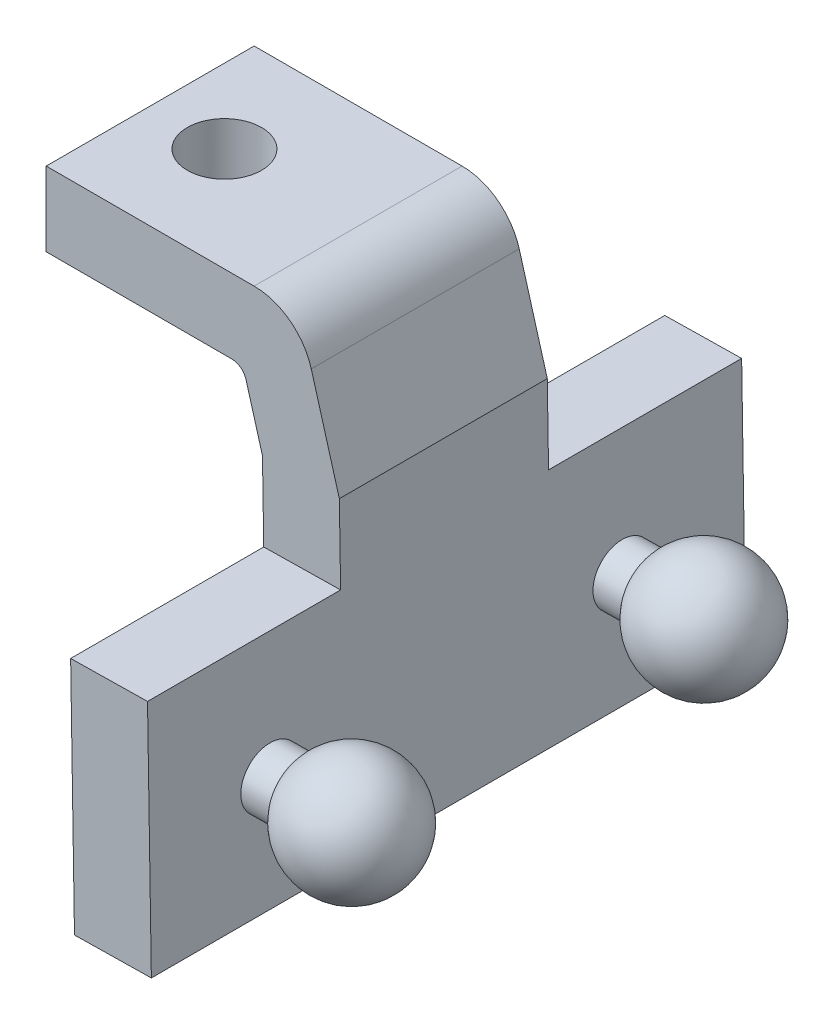
from build123d import *
from build123d.topology import SkipClean

# Parameters (mm, degrees)
EXTRUDE_1_DEPTH     = 3.5
SKETCH_2_R          = 1.25
CUT_EXTRUDE_3_DEPTH = 5.5
SKETCH_3_W          = 20
SKETCH_3_H          = 8
EXTRUDE_2_DEPTH     = 2.58819
SKETCH_4_R          = 1
EXTRUDE_3_DEPTH     = 1


with BuildPart() as part:
    # 草图1 → 凸台-拉伸1 (new, symmetric)
    with BuildSketch(Plane.XY):
        with BuildLine():
            Line((0, 0), (6.245432753, 0))
            ThreePointArc((6.245432753, 0), (6.54659813, -0.100876691), (6.72624124, -0.362802336))
            Line((6.72624124, -0.362802336), (7.280170813, -2.304045596))
            Line((7.280170813, -2.304045596), (7.452119079, -12.942527714))
            Line((7.452119079, -12.942527714), (10.039971529, -12.900700625))
            Line((10.039971529, -12.900700625), (9.868023263, -2.262218507))
            Line((9.868023263, -2.262218507), (8.923233948, 1.048790655))
            ThreePointArc((8.923233948, 1.048790655), (8.204661507, 2.096493237), (7, 2.5))
            Line((7, 2.5), (0, 2.5))
            Line((0, 2.5), (0, 0))
        make_face()
    extrude(amount=EXTRUDE_1_DEPTH, both=True)

    # 草图2 → 切除-拉伸3 (cut)
    with BuildSketch(Plane.XZ):
        with Locations((2.5, 0)):
            Circle(SKETCH_2_R)
    extrude(amount=-CUT_EXTRUDE_3_DEPTH, mode=Mode.SUBTRACT)

    # 草图3 → 凸台-拉伸2 (add)
    with SkipClean():  # the faces are left unmerged after this step: merging them gives an invalid solid
        with BuildSketch(Plane(origin=(9.828891669, 0.158862971, 0), x_dir=(0, 0, -1), z_dir=(0.9998694066117623, 0.016160746326906558, 0))):
            with Locations((0, -9.061269312)):
                Rectangle(SKETCH_3_W, SKETCH_3_H)
        extrude(amount=-EXTRUDE_2_DEPTH)

    # 草图4 → 凸台-拉伸3 (add)
    with SkipClean():  # the faces are left unmerged after this step: merging them gives an invalid solid
        with BuildSketch(Plane(origin=(9.828891669, 0.158862971, 0), x_dir=(0, 0, -1), z_dir=(0.9998694066117623, 0.016160746326906558, 0))):
            with Locations(Location((-5.928145029, -9.279203433, 0), (0, 0, 270))):
                Circle(SKETCH_4_R)
        extrude_3 = extrude(amount=EXTRUDE_3_DEPTH)

    # 草图5 → 旋转1 (revolve)
    with SkipClean():  # the faces are left unmerged after this step: merging them gives an invalid solid
        with BuildSketch(Plane(origin=(0.149958853, -9.27799163, 0), x_dir=(-0.9998694066117623, -0.016160746326906558, 0), z_dir=(-0.016160746326906558, 0.9998694066117623, 0))):
            with BuildLine():
                Line((-10.830175425, 5.928145029), (-14.562226233, 5.928145029))
                ThreePointArc((-14.562226233, 5.928145029), (-13.079864323, 7.859996681), (-10.830175425, 6.928145029))
                Line((-10.830175425, 6.928145029), (-10.830175425, 5.928145029))
            make_face()
        revolve_1 = revolve(axis=Axis((10.978719929, -9.102967912, 5.928145029), (0.9998694066117622, 0.016160746326906585, 0)))

    # 镜向1: 凸台-拉伸3, 旋转1 across plane
    with SkipClean():  # the faces are left unmerged after this step: merging them gives an invalid solid
        add(extrude_3.mirror(Plane.XY))
        add(revolve_1.mirror(Plane.XY))


solid = part.part
